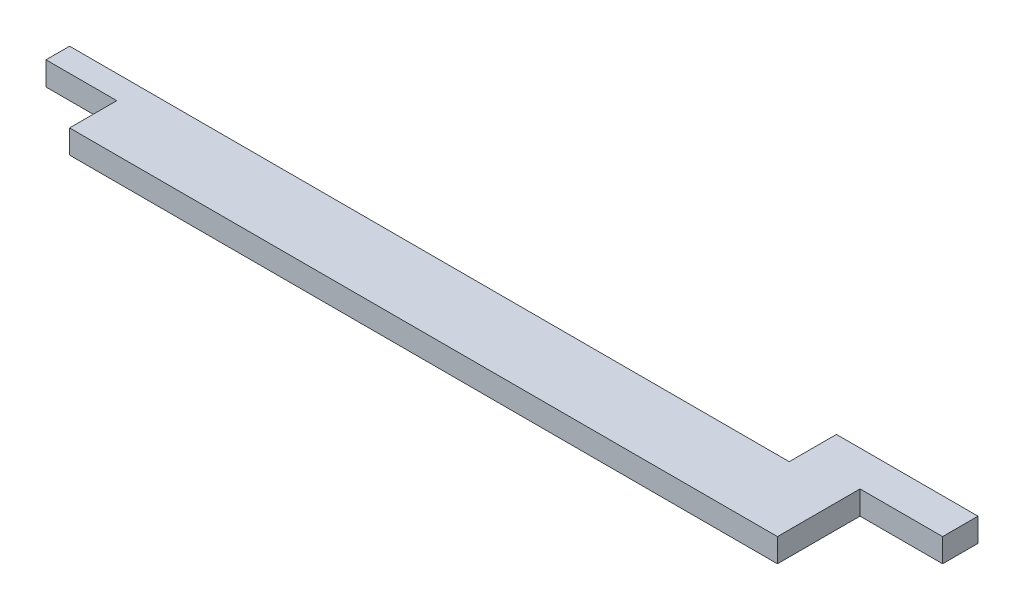
from build123d import *

# Parameters (mm, degrees)
SKETCH1_W           = 76.2
SKETCH1_H           = 2.54
BOSS_EXTRUDE1_DEPTH = 7.62
SKETCH3_W           = 2.54
SKETCH3_H           = 2.54
BOSS_EXTRUDE2_DEPTH = 7.62
SKETCH4_W           = 15.24
SKETCH4_H           = 2.54
BOSS_EXTRUDE3_DEPTH = 5.08
SKETCH5_W           = 1.27
SKETCH5_H           = 2.54
CUT_EXTRUDE2_DEPTH  = 8.89


with BuildPart() as part:
    # Sketch1 → Boss-Extrude1 (new body)
    with BuildSketch(Plane.XY):
        with Locations((38.1, 1.27)):
            Rectangle(SKETCH1_W, SKETCH1_H)
    extrude(amount=BOSS_EXTRUDE1_DEPTH)

    # Sketch3 → Boss-Extrude2 (add)
    with BuildSketch(Plane.ZY):
        with Locations((1.27, 1.27)):
            Rectangle(SKETCH3_W, SKETCH3_H)
    extrude(amount=BOSS_EXTRUDE2_DEPTH)

    # Sketch4 → Boss-Extrude3 (add)
    with BuildSketch(Plane(origin=(0, 0, 0), x_dir=(-1, 0, 0), z_dir=(0, 0, -1))):
        with Locations((-77.47, 1.27)):
            Rectangle(SKETCH4_W, SKETCH4_H)
    extrude(amount=BOSS_EXTRUDE3_DEPTH)

    # Sketch5 → Cut-Extrude2 (cut)
    with BuildSketch(Plane(origin=(85.09, 0, 0), x_dir=(0, 0, -1), z_dir=(1, 0, 0))):
        with Locations((0.635, 1.27)):
            Rectangle(SKETCH5_W, SKETCH5_H)
    extrude(amount=-CUT_EXTRUDE2_DEPTH, mode=Mode.SUBTRACT)


solid = part.part
